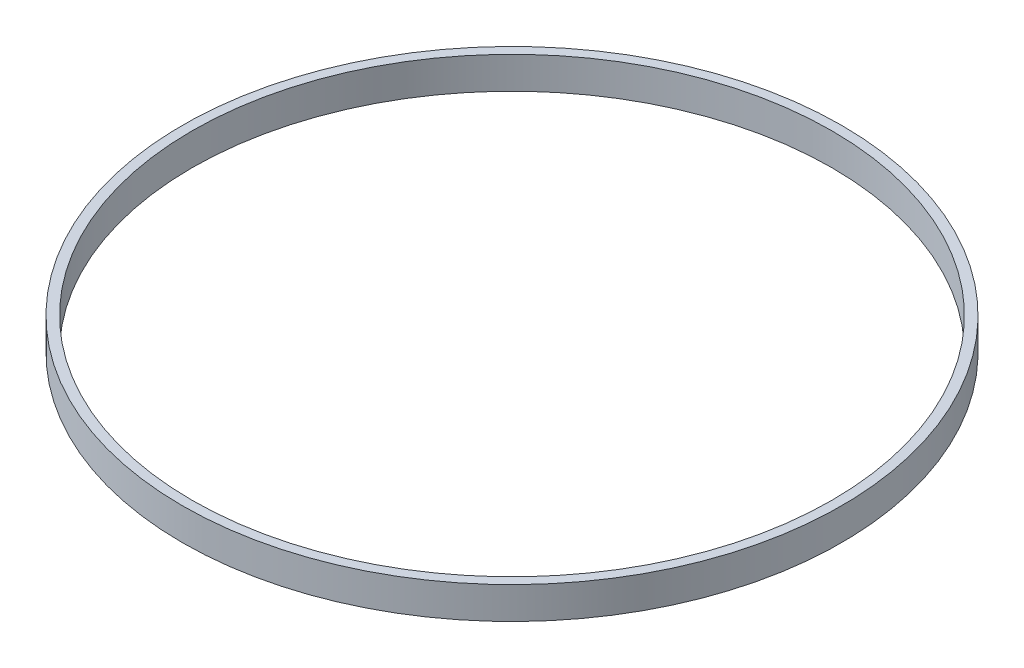
from build123d import *

# Parameters (mm, degrees)
SKETCH1_R           = 103
SKETCH1_R_2         = 100
BOSS_EXTRUDE1_DEPTH = 10


with BuildPart() as part:
    # Sketch1 → Boss-Extrude1 (new body)
    with BuildSketch(Plane(origin=(0, 0, 0), x_dir=(1, 0, 0), z_dir=(0, 1, 0))):
        with Locations(Location((0, 0, 0), (0, 0, 270))):
            Circle(SKETCH1_R)
        with Locations(Location((0, 0, 0), (0, 0, 270))):
            Circle(SKETCH1_R_2, mode=Mode.SUBTRACT)
    extrude(amount=BOSS_EXTRUDE1_DEPTH)


solid = part.part
